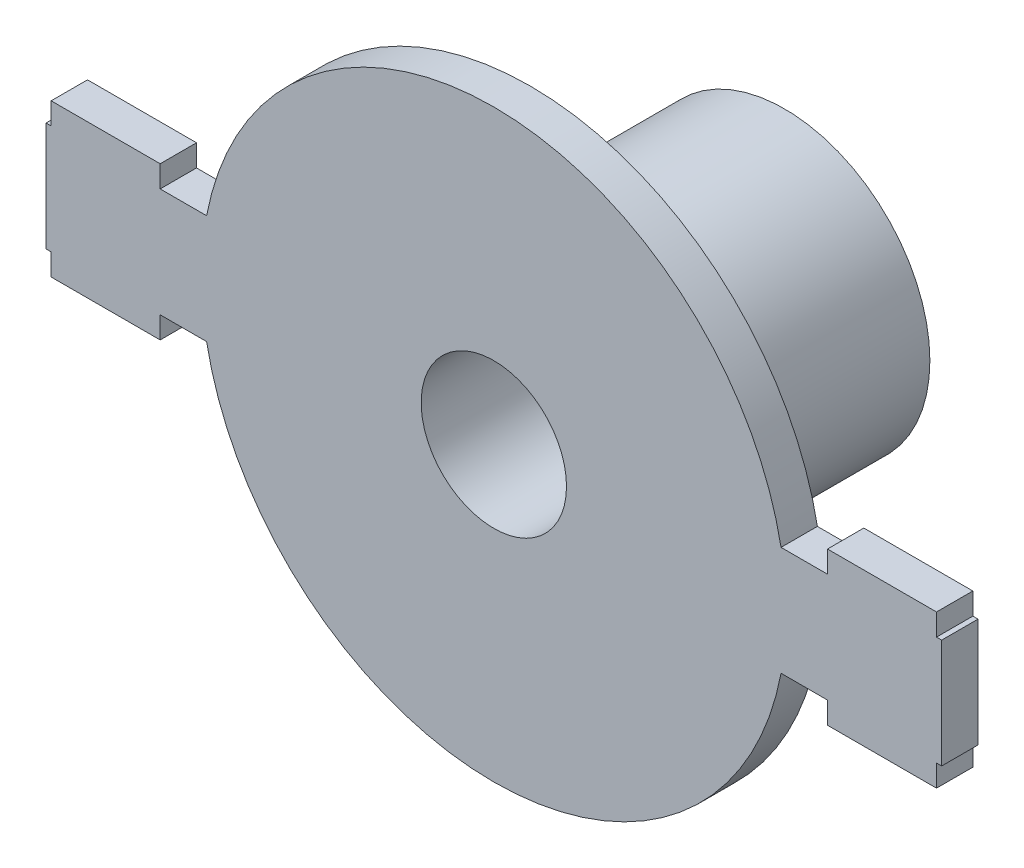
from build123d import *

# Parameters (mm, degrees)
IZIM1_R                           = 40.225
Y_KSEKLIK_EKSTR_ZYON1_DEPTH       = 5
IZIM2_W                           = 5
IZIM2_H                           = 15
Y_KSEKLIK_EKSTR_ZYON2_DEPTH       = 64
IZIM3_W                           = 8.48037671
IZIM3_H                           = 5
KES_EKSTR_ZYON1_DEPTH             = 128
IZIM6_R                           = 25
Y_KSEKLIK_EKSTR_ZYON4_DEPTH       = 5
IZIM7_W                           = 5
IZIM7_H                           = 5
Y_KSEKLIK_EKSTR_ZYON5_DEPTH       = 2
IZIM8_W                           = 5
IZIM8_H                           = 5
Y_KSEKLIK_EKSTR_ZYON6_DEPTH       = 7
IZIM9_W                           = 5.33982185
IZIM9_H                           = 8.96327239
KES_EKSTR_ZYON2_DEPTH             = 23
IZIM10_W                          = 16.71
IZIM10_H                          = 5
Y_KSEKLIK_EKSTR_ZYON7_DEPTH       = 15
IZIM13_W                          = 0.39
IZIM13_H                          = 5
Y_KSEKLIK_EKSTR_ZYON9_DEPTH       = 15
Y_KSEKLIK_EKSTR_ZYON10_DEPTH      = 3
Y_KSEKLIK_EKSTR_ZYON10_DEPTH_BACK = 18
IZIM14_W                          = 15
IZIM14_H                          = 5
IZIM11_W                          = 15.71
IZIM11_H                          = 5
Y_KSEKLIK_EKSTR_ZYON11_DEPTH      = 15
Y_KSEKLIK_EKSTR_ZYON12_DEPTH      = 3
Y_KSEKLIK_EKSTR_ZYON12_DEPTH_BACK = 18
IZIM16_W                          = 15
IZIM16_H                          = 5
IZIM17_W                          = 120.128605811
IZIM17_H                          = 27.620146719
KES_EKSTR_ZYON3_DEPTH             = 50
IZIM18_R                          = 5
KES_EKSTR_ZYON4_DEPTH             = 100
IZIM20_R                          = 20
IZIM20_R_2                        = 10
Y_KSEKLIK_EKSTR_ZYON14_DEPTH      = 35
IZIM21_R                          = 10
KES_EKSTR_ZYON5_DEPTH             = 45


with BuildPart() as part:
    # Çizim1 → Yükseklik-Ekstrüzyon1 (new body)
    with BuildSketch(Plane.XY):
        Circle(IZIM1_R)
    extrude(amount=Y_KSEKLIK_EKSTR_ZYON1_DEPTH)

    # Çizim2 → Yükseklik-Ekstrüzyon2 (add, symmetric)
    with BuildSketch(Plane(origin=(0, 0, 0), x_dir=(0, 0, -1), z_dir=(1, 0, 0))):
        with Locations((-2.5, 0)):
            Rectangle(IZIM2_W, IZIM2_H)
    extrude(amount=Y_KSEKLIK_EKSTR_ZYON2_DEPTH, both=True)

    # Çizim3 → Kes-Ekstrüzyon1 (cut)
    with BuildSketch(Plane.XZ.offset(7.5)):
        with Locations((-59.759811645, 2.5)):
            Rectangle(IZIM3_W, IZIM3_H)
    extrude(amount=-KES_EKSTR_ZYON1_DEPTH, mode=Mode.SUBTRACT)

    # Çizim7 → Yükseklik-Ekstrüzyon5 (add)
    with BuildSketch(Plane.XY.offset(5)):
        Polygon((35.024990748, -17.334936491), (30.694863729, -14.834936491), (28.194863729, -19.165063509), (32.524990748, -21.665063509), align=None)
        with Locations((0, 36.5)):
            Rectangle(IZIM7_W, IZIM7_H)
        Polygon((-32.524990748, -21.665063509), (-28.194863729, -19.165063509), (-30.694863729, -14.834936491), (-35.024990748, -17.334936491), align=None)
    extrude(amount=Y_KSEKLIK_EKSTR_ZYON5_DEPTH)


with BuildPart() as body_2:
    # Çizim6 → Yükseklik-Ekstrüzyon4 (new body)
    with BuildSketch(Plane.XY.offset(25)):
        Circle(IZIM6_R)
    extrude(amount=Y_KSEKLIK_EKSTR_ZYON4_DEPTH)

    # Çizim8 → Yükseklik-Ekstrüzyon6 (add)
    with BuildSketch(Plane.XY.offset(30)):
        Polygon((22.034609691, -9.834936491), (17.704482672, -7.334936491), (15.204482672, -11.665063509), (19.534609691, -14.165063509), align=None)
        with Locations((0, 21.5)):
            Rectangle(IZIM8_W, IZIM8_H)
        Polygon((-19.534609691, -14.165063509), (-15.204482672, -11.665063509), (-17.704482672, -7.334936491), (-22.034609691, -9.834936491), align=None)
    extrude(amount=-Y_KSEKLIK_EKSTR_ZYON6_DEPTH)


    add(part.part)  # loft1 joins it to this body
    # loft from a face of the part (loft1)
    loft([body_2.faces().sort_by_distance((-18.619546181, -10.75, 23))[0], body_2.faces().sort_by_distance((-31.609927238, -18.25, 7))[0]])

    # loft from a face of the part (loft3)
    loft([body_2.faces().sort_by_distance((0, 36.5, 7))[0], body_2.faces().sort_by_distance((0, 21.5, 23))[0]])

    # Çizim9 → Kes-Ekstrüzyon2 (cut)
    with BuildSketch(Plane.XZ.offset(7.5)):
        with Locations((62.899534215, 2.077883617)):
            Rectangle(IZIM9_W, IZIM9_H)
    extrude(amount=-KES_EKSTR_ZYON2_DEPTH, mode=Mode.SUBTRACT)

    # Çizim10 → Yükseklik-Ekstrüzyon7 (add)
    with BuildSketch(Plane.XZ.offset(7.5)):
        with Locations((-52.87462329, 2.5)):
            Rectangle(IZIM10_W, IZIM10_H)
    extrude(amount=-Y_KSEKLIK_EKSTR_ZYON7_DEPTH)

    # Çizim13 → Yükseklik-Ekstrüzyon9 (add)
    with BuildSketch(Plane.XZ.offset(7.5)):
        with Locations((-61.42462329, 2.5)):
            Rectangle(IZIM13_W, IZIM13_H)
    extrude(amount=-Y_KSEKLIK_EKSTR_ZYON9_DEPTH)

    # Çizim14 → Yükseklik-Ekstrüzyon10 (add, two sides: drawn at the far end of the back side and taken through both)
    with BuildSketch(Plane.XZ.offset(7.5).offset(-Y_KSEKLIK_EKSTR_ZYON10_DEPTH_BACK)):
        with Locations((-53.40962329, 2.5)):
            Rectangle(IZIM14_W, IZIM14_H)
    extrude(amount=Y_KSEKLIK_EKSTR_ZYON10_DEPTH + Y_KSEKLIK_EKSTR_ZYON10_DEPTH_BACK)

    # Çizim11 → Yükseklik-Ekstrüzyon11 (add)
    with BuildSketch(Plane.XZ.offset(7.5)):
        with Locations((53.76462329, 2.5)):
            Rectangle(IZIM11_W, IZIM11_H)
    extrude(amount=-Y_KSEKLIK_EKSTR_ZYON11_DEPTH)

    # Çizim16 → Yükseklik-Ekstrüzyon12 (add, two sides: drawn at the far end of the back side and taken through both)
    with BuildSketch(Plane.XZ.offset(7.5).offset(-Y_KSEKLIK_EKSTR_ZYON12_DEPTH_BACK)):
        with Locations((53.40962329, 2.5)):
            Rectangle(IZIM16_W, IZIM16_H)
    extrude(amount=Y_KSEKLIK_EKSTR_ZYON12_DEPTH + Y_KSEKLIK_EKSTR_ZYON12_DEPTH_BACK)

    # Çizim17 → Kes-Ekstrüzyon3 (cut, symmetric)
    with BuildSketch(Plane(origin=(0, 0, 0), x_dir=(1, 0, 0), z_dir=(0, 1, 0))):
        with Locations((6.654679615, -18.81007336)):
            Rectangle(IZIM17_W, IZIM17_H)
    extrude(amount=KES_EKSTR_ZYON3_DEPTH, both=True, mode=Mode.SUBTRACT)

    # Çizim18 → Kes-Ekstrüzyon4 (cut)
    with BuildSketch(Plane(origin=(0, 0, 0), x_dir=(-1, 0, 0), z_dir=(0, 0, -1))):
        Circle(IZIM18_R)
    extrude(amount=-KES_EKSTR_ZYON4_DEPTH, mode=Mode.SUBTRACT)

    # Çizim20 → Yükseklik-Ekstrüzyon14 (add)
    with BuildSketch(Plane(origin=(0, 0, 0), x_dir=(-1, 0, 0), z_dir=(0, 0, -1))):
        with Locations(Location((0, 0, 0), (0, 0, 180))):
            Circle(IZIM20_R)
        Circle(IZIM20_R_2, mode=Mode.SUBTRACT)
    extrude(amount=Y_KSEKLIK_EKSTR_ZYON14_DEPTH)

    # Çizim21 → Kes-Ekstrüzyon5 (cut)
    with BuildSketch(Plane(origin=(0, 0, 0), x_dir=(-1, 0, 0), z_dir=(0, 0, -1))):
        with Locations(Location((0, 0, 0), (0, 0, 180))):
            Circle(IZIM21_R)
    extrude(amount=-KES_EKSTR_ZYON5_DEPTH, mode=Mode.SUBTRACT)


solid = body_2.part
